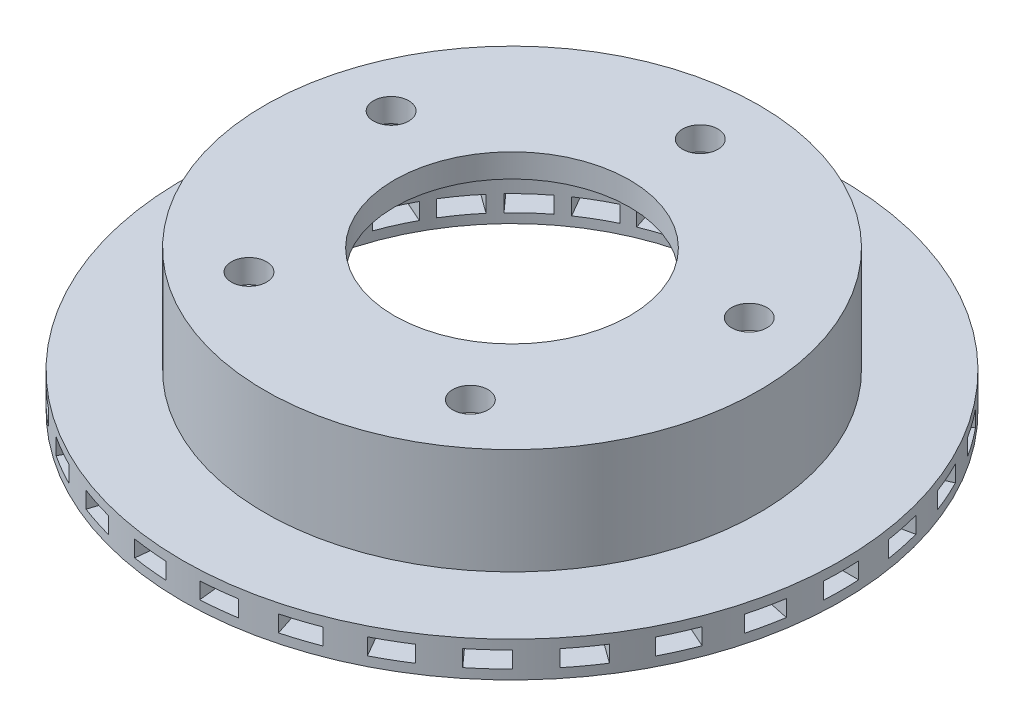
from build123d import *

# Parameters (mm, degrees)
SKETCH1_R               = 140
BOSS_EXTRUDE1_DEPTH     = 7.5
CUT_EXTRUDE1_DEPTH      = 199.557296517
CUT_EXTRUDE1_DEPTH_BACK = 199.557296517
SKETCH2_R               = 97.5
SKETCH3_R               = 105
BOSS_EXTRUDE2_DEPTH     = 45
SKETCH5_R               = 50
CUT_EXTRUDE2_DEPTH      = 207.881608656
SKETCH7_R               = 7.5
CUT_EXTRUDE3_DEPTH      = 207.881608656
CIRPATTERN1_COUNT       = 5
SKETCH9_W               = 15
SKETCH9_H               = 7
CUT_EXTRUDE4_DEPTH      = 318.421250076
CIRPATTERN2_COUNT       = 30
SKETCH11_R              = 96.873816077
CUT_EXTRUDE5_DEPTH      = 35
CUT_EXTRUDE6_START      = -35
SKETCH12_R              = 97.5
CUT_EXTRUDE6_DEPTH      = 35


with BuildPart() as part:
    # Sketch1 → Boss-Extrude1 (new, symmetric)
    with BuildSketch(Plane(origin=(0, 0, 0), x_dir=(1, 0, 0), z_dir=(0, 1, 0))):
        with Locations(Location((0, 0, 0), (0, 0, 270))):
            Circle(SKETCH1_R)
    extrude(amount=BOSS_EXTRUDE1_DEPTH, both=True)

    # Sketch2 → Cut-Extrude1 (cut, two sides: drawn at the far end of the back side and taken through both)
    with BuildSketch(Plane(origin=(0, 7.5, 0), x_dir=(1, 0, 0), z_dir=(0, 1, 0)).offset(-CUT_EXTRUDE1_DEPTH_BACK)):
        with Locations(Location((0, 0, 0), (0, 0, 270))):
            Circle(SKETCH2_R)
    extrude(amount=CUT_EXTRUDE1_DEPTH + CUT_EXTRUDE1_DEPTH_BACK, mode=Mode.SUBTRACT)

    # Sketch3 → Boss-Extrude2 (add)
    with BuildSketch(Plane(origin=(0, 7.5, 0), x_dir=(1, 0, 0), z_dir=(0, 1, 0))):
        with Locations(Location((0, 0, 0), (0, 0, 90))):
            Circle(SKETCH3_R)
    extrude(amount=BOSS_EXTRUDE2_DEPTH)

    # Sketch5 → Cut-Extrude2 (cut, through all)
    with BuildSketch(Plane(origin=(0, 52.5, 0), x_dir=(1, 0, 0), z_dir=(0, 1, 0))):
        with Locations(Location((0, 0, 0), (0, 0, 270))):
            Circle(SKETCH5_R)
    extrude(amount=-CUT_EXTRUDE2_DEPTH, mode=Mode.SUBTRACT)

    # Sketch7 → Cut-Extrude3 (cut, symmetric)
    with BuildSketch(Plane(origin=(0, 52.5, 0), x_dir=(1, 0, 0), z_dir=(0, 1, 0))):
        with Locations(Location((0, 80, 0), (0, 0, 270))):
            Circle(SKETCH7_R)
    cut_extrude3 = extrude(amount=CUT_EXTRUDE3_DEPTH, both=True, mode=Mode.SUBTRACT)

    # CirPattern1: Cut-Extrude3 ×5 about axis
    cirpattern1_axis = Axis((0, 0, 0), (0, 1, 0))
    for i in range(1, CIRPATTERN1_COUNT):
        add(cut_extrude3.rotate(cirpattern1_axis, i * 360 / CIRPATTERN1_COUNT), mode=Mode.SUBTRACT)

    # Sketch9 → Cut-Extrude4 (cut, symmetric)
    with BuildSketch(Plane(origin=(140, 0, 0), x_dir=(0, 0, -1), z_dir=(1, 0, 0))):
        Rectangle(SKETCH9_W, SKETCH9_H)
    cut_extrude4 = extrude(amount=CUT_EXTRUDE4_DEPTH, both=True, mode=Mode.SUBTRACT)

    # CirPattern2: Cut-Extrude4 ×30 about axis
    cirpattern2_axis = Axis((0, 0, 0), (0, 1, 0))
    for i in range(1, CIRPATTERN2_COUNT):
        add(cut_extrude4.rotate(cirpattern2_axis, i * 360 / CIRPATTERN2_COUNT), mode=Mode.SUBTRACT)

    # Sketch11 → Cut-Extrude5 (cut)
    with BuildSketch(Plane.XZ.offset(-7.5)):
        with Locations(Location((0, 0, 0), (0, 0, 270))):
            Circle(SKETCH11_R)
    extrude(amount=-CUT_EXTRUDE5_DEPTH, mode=Mode.SUBTRACT)

    # Sketch12 → Cut-Extrude6 (cut)
    with BuildSketch(Plane.XZ.offset(-7.5).offset(CUT_EXTRUDE6_START)):
        with Locations(Location((0, 0, 0), (0, 0, 90))):
            Circle(SKETCH12_R)
    extrude(amount=CUT_EXTRUDE6_DEPTH, mode=Mode.SUBTRACT)


solid = part.part
